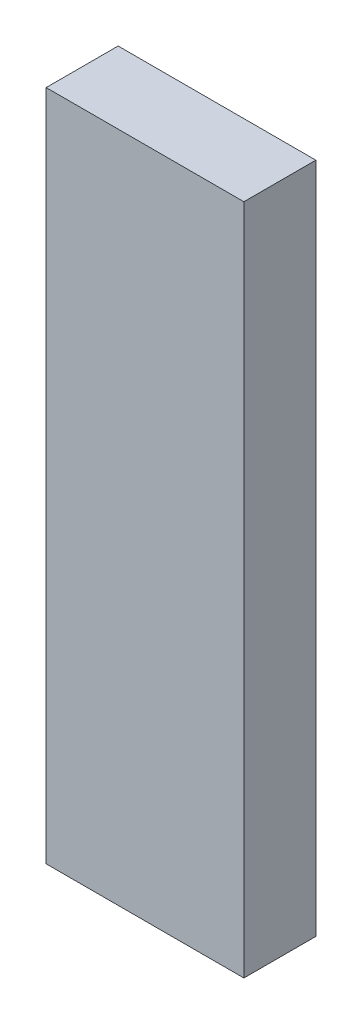
from build123d import *

# Parameters (mm, degrees)
SKETCH1_W           = 1.82
SKETCH1_H           = 17
BOSS_EXTRUDE1_DEPTH = 2.5


with BuildPart() as part:
    # Sketch1 → Boss-Extrude1 (new, symmetric)
    with BuildSketch(Plane(origin=(0, 0, 0), x_dir=(0, 0, -1), z_dir=(1, 0, 0))):
        with Locations((-0.91, 8.5)):
            Rectangle(SKETCH1_W, SKETCH1_H)
    extrude(amount=BOSS_EXTRUDE1_DEPTH, both=True)


solid = part.part
